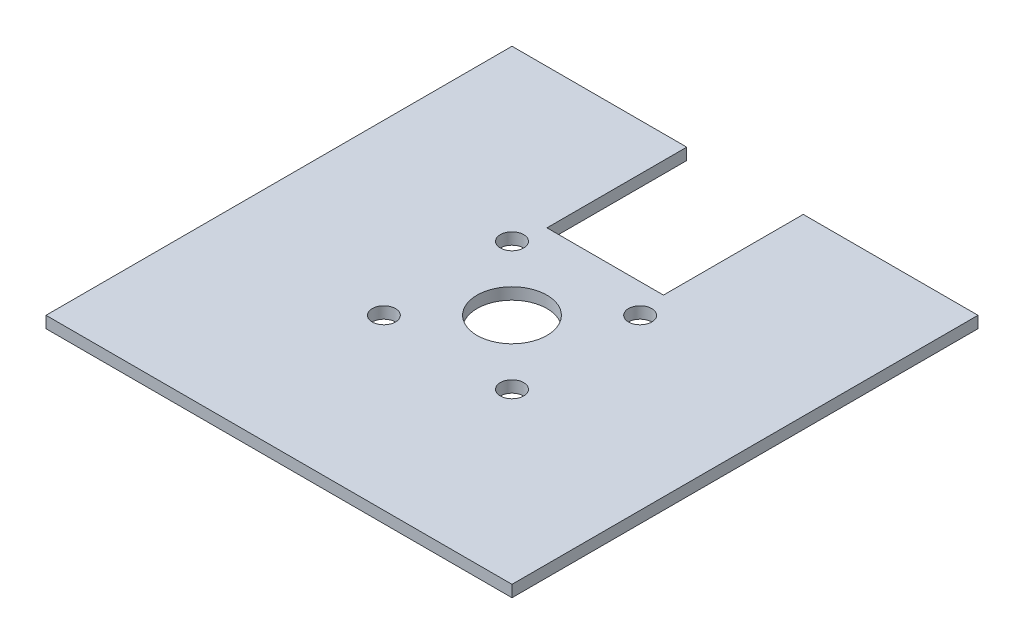
from build123d import *

# Parameters (mm, degrees)
SKETCH1_R           = 19.05
SKETCH1_R_2         = 6.35
BOSS_EXTRUDE1_DEPTH = 3.175


with BuildPart() as part:
    # Sketch1 → Boss-Extrude1 (new, symmetric)
    with BuildSketch(Plane(origin=(0, 0, 0), x_dir=(1, 0, 0), z_dir=(0, 1, 0))):
        Polygon((-31.75, 50.8), (31.75, 50.8), (31.75, 127), (127, 127), (127, -127), (-127, -127), (-127, 127), (-31.75, 127), align=None)
        with Locations(Location((0, 0, 0), (0, 0, 270))):
            Circle(SKETCH1_R, mode=Mode.SUBTRACT)
        with Locations(Location((-34.925, 34.925, 0), (0, 0, 270))):
            Circle(SKETCH1_R_2, mode=Mode.SUBTRACT)
        with Locations(Location((34.925, 34.925, 0), (0, 0, 90))):
            Circle(SKETCH1_R_2, mode=Mode.SUBTRACT)
        with Locations(Location((34.925, -34.925, 0), (0, 0, 270))):
            Circle(SKETCH1_R_2, mode=Mode.SUBTRACT)
        with Locations(Location((-34.925, -34.925, 0), (0, 0, 90))):
            Circle(SKETCH1_R_2, mode=Mode.SUBTRACT)
    extrude(amount=BOSS_EXTRUDE1_DEPTH, both=True)


solid = part.part
